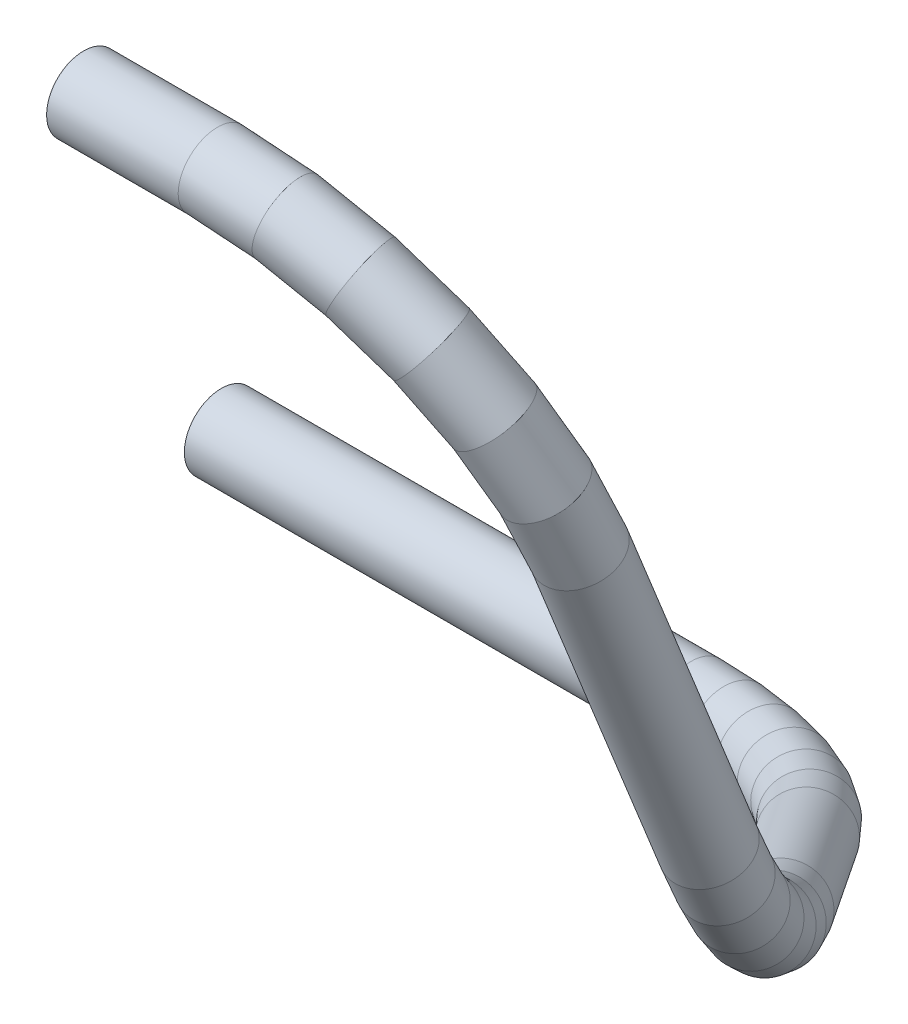
from build123d import *

# Parameters (mm, degrees)
PROFILE_R   = 2.5
PROFILE_R_2 = 1


with BuildPart() as part:
    # Tube: sweep along a curve in space
    with BuildLine() as tube_path:
        Line((-571, -44.888766616, -108.371069164), (-539.067063489, -44.888766616, -108.371069164))
        Line((-539.067063489, -44.888766616, -108.371069164), (-536.278596322, -44.805609846, -108.170310961))
        Line((-536.278596322, -44.805609846, -108.170310961), (-533.55745487, -44.558147302, -107.57288353))
        Line((-533.55745487, -44.558147302, -107.57288353), (-530.969339315, -44.152353804, -106.593211363))
        Line((-530.969339315, -44.152353804, -106.593211363), (-528.576738012, -43.598026971, -105.254948006))
        Line((-528.576738012, -43.598026971, -105.254948006), (-526.437418755, -42.908550662, -103.59040495))
        Line((-526.437418755, -42.908550662, -103.59040495), (-524.603034008, -42.100571832, -101.6397715))
        Line((-524.603034008, -42.100571832, -101.6397715), (-517.670781542, -38.519213305, -92.993607173))
        Line((-517.670781542, -38.519213305, -92.993607173), (-516.035577188, -37.409138693, -90.847413894))
        Line((-516.035577188, -37.409138693, -90.847413894), (-514.634754322, -35.896538669, -88.78294278))
        Line((-514.634754322, -35.896538669, -88.78294278), (-513.505116127, -34.021153084, -86.85443274))
        Line((-513.505116127, -34.021153084, -86.85443274), (-512.676341071, -31.832253091, -85.112550642))
        Line((-512.676341071, -31.832253091, -85.112550642), (-512.170203185, -29.387346663, -83.60306016))
        Line((-512.170203185, -29.387346663, -83.60306016), (-512, -26.750667714, -82.365619452))
        Line((-512, -26.750667714, -82.365619452), (-512, -4.999767139, -73.616976814))
        Line((-512, -4.999767139, -73.616976814), (-512.613335127, -0.677549354, -71.878495289))
        Line((-512.613335127, -0.677549354, -71.878495289), (-514.411542732, 3.350116431, -70.258488407))
        Line((-514.411542732, 3.350116431, -70.258488407), (-517.272077939, 6.808751449, -68.86735696))
        Line((-517.272077939, 6.808751449, -68.86735696), (-521, 9.462655441, -67.799904256))
        Line((-521, 9.462655441, -67.799904256), (-525.341257188, 11.130969234, -67.128875435))
        Line((-525.341257188, 11.130969234, -67.128875435), (-530, 11.7, -66.9))
        Line((-530, 11.7, -66.9), (-538.85, 11.7, -66.9))
    # Profile → Tube (sweep)
    with BuildSketch(Plane(origin=(-571, 0, 0), x_dir=(0, 0, -1), z_dir=(1, 0, 0))):
        with Locations((108.371069164, -44.888766616)):
            Circle(PROFILE_R)
        with Locations((108.371069164, -44.888766616)):
            Circle(PROFILE_R_2, mode=Mode.SUBTRACT)
    sweep(path=tube_path.line, transition=Transition.RIGHT)


solid = part.part
